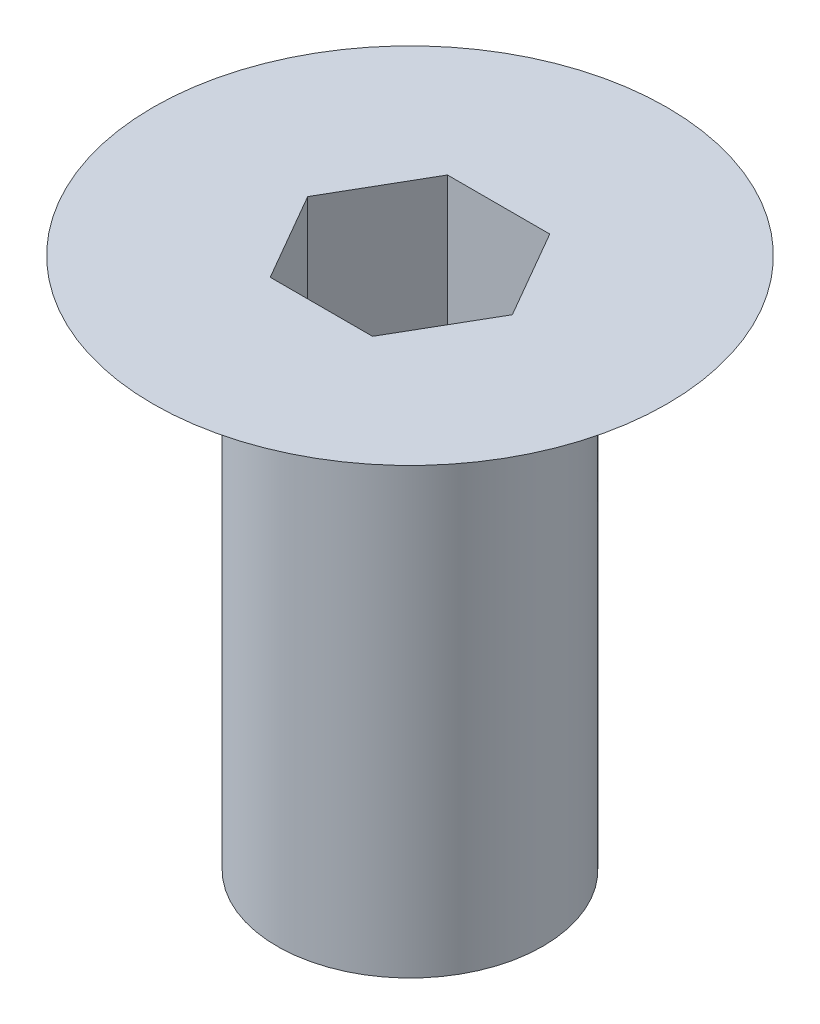
from build123d import *

# Parameters (mm, degrees)
CUT_EXTRUDE1_DEPTH = 1.5


with BuildPart() as part:
    # Sketch1 → Revolve1 (revolve)
    with BuildSketch(Plane.XY, mode=Mode.PRIVATE) as revolve1_sk:
        Polygon((0, 0), (-2.9, 0), (-1.5, -0.841204867), (-1.5, -6), (0, -6), align=None)
    revolve(revolve1_sk.sketch.rotate(Axis((0, -6, 0), (0, 1, 0)), 180), axis=Axis((0, -6, 0), (0, 1, 0)))

    # Sketch2 → Cut-Extrude1 (cut)
    with BuildSketch(Plane(origin=(0, 0, 0), x_dir=(1, 0, 0), z_dir=(0, 1, 0))):
        Polygon((0.577350269, 1), (-0.577350269, 1), (-1.154700538, 0), (-0.577350269, -1), (0.577350269, -1), (1.154700538, 0), align=None)
    extrude(amount=-CUT_EXTRUDE1_DEPTH, mode=Mode.SUBTRACT)


solid = part.part
